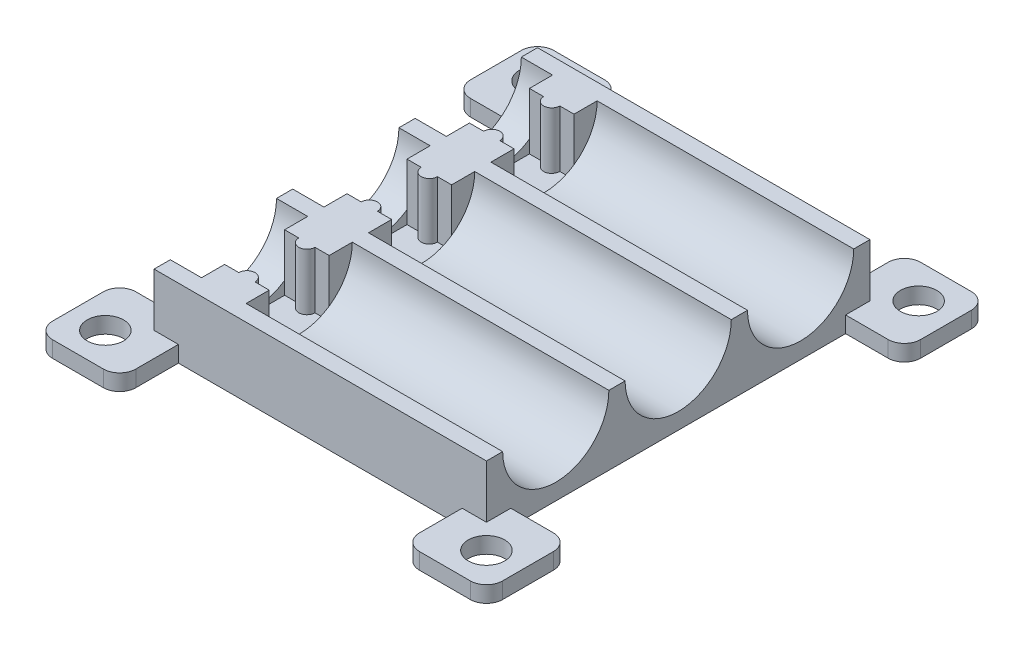
from build123d import *

# Parameters (mm, degrees)
BOSS_EXTRUDE1_DEPTH = 41
BOSS_EXTRUDE2_REACH = 50.098
SKETCH2_R           = 1
SKETCH4_W           = 5.5
SKETCH4_H           = 13.1
SKETCH4_R           = 1
CUT_EXTRUDE1_DEPTH  = 7
SKETCH5_R           = 2.25
BOSS_EXTRUDE3_DEPTH = 2
BOSS_EXTRUDE4_REACH = 59.938
SKETCH6_W           = 5.5
SKETCH6_H           = 2.85


with BuildPart() as part:
    # Sketch1 → Boss-Extrude1 (new body)
    with BuildSketch(Plane(origin=(0, 0, 0), x_dir=(0, 0, -1), z_dir=(1, 0, 0))):
        with BuildLine():
            Line((-8.55, 0), (-6.55, 0))
            ThreePointArc((-6.55, 0), (0, -6.55), (6.55, 0))
            Line((6.55, 0), (8.55, 0))
            ThreePointArc((8.55, 0), (15.1, -6.55), (21.65, 0))
            Line((21.65, 0), (23.65, 0))
            Line((23.65, 0), (23.65, -8.55))
            Line((23.65, -8.55), (-23.65, -8.55))
            Line((-23.65, -8.55), (-23.65, 0))
            Line((-23.65, 0), (-21.65, 0))
            ThreePointArc((-21.65, 0), (-15.1, -6.55), (-8.55, 0))
        make_face()
    extrude(amount=BOSS_EXTRUDE1_DEPTH)

    # Sketch2 → Boss-Extrude2 (add, up to next)
    with BuildSketch(Plane(origin=(0, 0, 0), x_dir=(1, 0, 0), z_dir=(0, 1, 0)), mode=Mode.PRIVATE) as boss_extrude2_sk1:
        with Locations(Location((6.6, 3.7, 0), (0, 0, 270))):
            Circle(SKETCH2_R)
    boss_extrude2_tool1 = extrude(boss_extrude2_sk1.sketch, amount=-BOSS_EXTRUDE2_REACH, mode=Mode.PRIVATE) - part.part
    # Sketch2 → Boss-Extrude2 (add, up to next)
    with BuildSketch(Plane(origin=(0, 0, 0), x_dir=(1, 0, 0), z_dir=(0, 1, 0)), mode=Mode.PRIVATE) as boss_extrude2_sk2:
        with Locations(Location((6.6, -3.7, 0), (0, 0, 270))):
            Circle(SKETCH2_R)
    boss_extrude2_tool2 = extrude(boss_extrude2_sk2.sketch, amount=-BOSS_EXTRUDE2_REACH, mode=Mode.PRIVATE) - part.part
    # Sketch2 → Boss-Extrude2 (add, up to next)
    with BuildSketch(Plane(origin=(0, 0, 0), x_dir=(1, 0, 0), z_dir=(0, 1, 0)), mode=Mode.PRIVATE) as boss_extrude2_sk3:
        with Locations(Location((6.6, -11.4, 0), (0, 0, 270))):
            Circle(SKETCH2_R)
    boss_extrude2_tool3 = extrude(boss_extrude2_sk3.sketch, amount=-BOSS_EXTRUDE2_REACH, mode=Mode.PRIVATE) - part.part
    # Sketch2 → Boss-Extrude2 (add, up to next)
    with BuildSketch(Plane(origin=(0, 0, 0), x_dir=(1, 0, 0), z_dir=(0, 1, 0)), mode=Mode.PRIVATE) as boss_extrude2_sk4:
        with Locations(Location((6.6, -18.8, 0), (0, 0, 270))):
            Circle(SKETCH2_R)
    boss_extrude2_tool4 = extrude(boss_extrude2_sk4.sketch, amount=-BOSS_EXTRUDE2_REACH, mode=Mode.PRIVATE) - part.part
    # Sketch2 → Boss-Extrude2 (add, up to next)
    with BuildSketch(Plane(origin=(0, 0, 0), x_dir=(1, 0, 0), z_dir=(0, 1, 0)), mode=Mode.PRIVATE) as boss_extrude2_sk5:
        with Locations(Location((6.6, 18.8, 0), (0, 0, 270))):
            Circle(SKETCH2_R)
    boss_extrude2_tool5 = extrude(boss_extrude2_sk5.sketch, amount=-BOSS_EXTRUDE2_REACH, mode=Mode.PRIVATE) - part.part
    # Sketch2 → Boss-Extrude2 (add, up to next)
    with BuildSketch(Plane(origin=(0, 0, 0), x_dir=(1, 0, 0), z_dir=(0, 1, 0)), mode=Mode.PRIVATE) as boss_extrude2_sk6:
        with Locations(Location((6.6, 11.4, 0), (0, 0, 270))):
            Circle(SKETCH2_R)
    boss_extrude2_tool6 = extrude(boss_extrude2_sk6.sketch, amount=-BOSS_EXTRUDE2_REACH, mode=Mode.PRIVATE) - part.part
    add(boss_extrude2_tool1.solids().sort_by_distance((6.6, 0, -3.7))[0])
    add(boss_extrude2_tool2.solids().sort_by_distance((6.6, 0, 3.7))[0])
    add(boss_extrude2_tool3.solids().sort_by_distance((6.6, 0, 11.4))[0])
    add(boss_extrude2_tool4.solids().sort_by_distance((6.6, 0, 18.8))[0])
    add(boss_extrude2_tool5.solids().sort_by_distance((6.6, 0, -18.8))[0])
    add(boss_extrude2_tool6.solids().sort_by_distance((6.6, 0, -11.4))[0])

    # Sketch4 → Cut-Extrude1 (cut)
    # profile 1 of 3: a face of its own
    with BuildSketch(Plane(origin=(0, 0, 0), x_dir=(1, 0, 0), z_dir=(0, 1, 0))):
        with Locations((6.6, 0)):
            Rectangle(SKETCH4_W, SKETCH4_H)
        with Locations(Location((6.6, 3.7, 0), (0, 0, 270))):
            Circle(SKETCH4_R, mode=Mode.SUBTRACT)
        with Locations(Location((6.6, -3.7, 0), (0, 0, 270))):
            Circle(SKETCH4_R, mode=Mode.SUBTRACT)
    # profile 2 of 3: a face of its own
    with BuildSketch(Plane(origin=(0, 0, 0), x_dir=(1, 0, 0), z_dir=(0, 1, 0))):
        with Locations((6.6, -15.1)):
            Rectangle(SKETCH4_W, SKETCH4_H)
        with Locations(Location((6.6, -11.4, 0), (0, 0, 90))):
            Circle(SKETCH4_R, mode=Mode.SUBTRACT)
        with Locations(Location((6.6, -18.8, 0), (0, 0, 90))):
            Circle(SKETCH4_R, mode=Mode.SUBTRACT)
    # profile 3 of 3: a face of its own
    with BuildSketch(Plane(origin=(0, 0, 0), x_dir=(1, 0, 0), z_dir=(0, 1, 0))):
        with Locations((6.6, 15.1)):
            Rectangle(SKETCH4_W, SKETCH4_H)
        with Locations(Location((6.6, 11.4, 0), (0, 0, 90))):
            Circle(SKETCH4_R, mode=Mode.SUBTRACT)
        with Locations(Location((6.6, 18.8, 0), (0, 0, 90))):
            Circle(SKETCH4_R, mode=Mode.SUBTRACT)
    extrude(amount=-CUT_EXTRUDE1_DEPTH, mode=Mode.SUBTRACT)

    # Sketch5 → Boss-Extrude3 (add)
    # profile 1 of 4: a face of its own
    with BuildSketch(Plane.XZ.offset(8.55)):
        with BuildLine():
            Line((0, 23.65), (0, 20.65))
            Line((0, 20.65), (-5.25520382, 20.65))
            ThreePointArc((-5.25520382, 20.65), (-6.669417382, 21.235786438), (-7.25520382, 22.65))
            Line((-7.25520382, 22.65), (-7.25520382, 28.90520382))
            ThreePointArc((-7.25520382, 28.90520382), (-6.669417382, 30.319417382), (-5.25520382, 30.90520382))
            Line((-5.25520382, 30.90520382), (1, 30.90520382))
            ThreePointArc((1, 30.90520382), (2.414213562, 30.319417382), (3, 28.90520382))
            Line((3, 28.90520382), (3, 23.65))
            Line((3, 23.65), (0, 23.65))
        make_face()
        with Locations(Location((-3.00520382, 26.65520382, 0), (0, 0, 270))):
            Circle(SKETCH5_R, mode=Mode.SUBTRACT)
    # profile 2 of 4: a face of its own
    with BuildSketch(Plane.XZ.offset(8.55)):
        with BuildLine():
            Line((0, -23.65), (3, -23.65))
            Line((3, -23.65), (3, -28.90520382))
            ThreePointArc((3, -28.90520382), (2.414213562, -30.319417382), (1, -30.90520382))
            Line((1, -30.90520382), (-5.25520382, -30.90520382))
            ThreePointArc((-5.25520382, -30.90520382), (-6.669417382, -30.319417382), (-7.25520382, -28.90520382))
            Line((-7.25520382, -28.90520382), (-7.25520382, -22.65))
            ThreePointArc((-7.25520382, -22.65), (-6.669417382, -21.235786438), (-5.25520382, -20.65))
            Line((-5.25520382, -20.65), (0, -20.65))
            Line((0, -20.65), (0, -23.65))
        make_face()
        with Locations(Location((-3.00520382, -26.65520382, 0), (0, 0, 90))):
            Circle(SKETCH5_R, mode=Mode.SUBTRACT)
    # profile 3 of 4: a face of its own
    with BuildSketch(Plane.XZ.offset(8.55)):
        with BuildLine():
            Line((41, -23.65), (41, -20.65))
            Line((41, -20.65), (46.25520382, -20.65))
            ThreePointArc((46.25520382, -20.65), (47.669417382, -21.235786438), (48.25520382, -22.65))
            Line((48.25520382, -22.65), (48.25520382, -28.90520382))
            ThreePointArc((48.25520382, -28.90520382), (47.669417382, -30.319417382), (46.25520382, -30.90520382))
            Line((46.25520382, -30.90520382), (40, -30.90520382))
            ThreePointArc((40, -30.90520382), (38.585786438, -30.319417382), (38, -28.90520382))
            Line((38, -28.90520382), (38, -23.65))
            Line((38, -23.65), (41, -23.65))
        make_face()
        with Locations(Location((44.00520382, -26.65520382, 0), (0, 0, 270))):
            Circle(SKETCH5_R, mode=Mode.SUBTRACT)
    # profile 4 of 4: a face of its own
    with BuildSketch(Plane.XZ.offset(8.55)):
        with BuildLine():
            Line((41, 23.65), (38, 23.65))
            Line((38, 23.65), (38, 28.90520382))
            ThreePointArc((38, 28.90520382), (38.585786438, 30.319417382), (40, 30.90520382))
            Line((40, 30.90520382), (46.25520382, 30.90520382))
            ThreePointArc((46.25520382, 30.90520382), (47.669417382, 30.319417382), (48.25520382, 28.90520382))
            Line((48.25520382, 28.90520382), (48.25520382, 22.65))
            ThreePointArc((48.25520382, 22.65), (47.669417382, 21.235786438), (46.25520382, 20.65))
            Line((46.25520382, 20.65), (41, 20.65))
            Line((41, 20.65), (41, 23.65))
        make_face()
        with Locations(Location((44.00520382, 26.65520382, 0), (0, 0, 90))):
            Circle(SKETCH5_R, mode=Mode.SUBTRACT)
    extrude(amount=-BOSS_EXTRUDE3_DEPTH)

    # Boss-Extrude4: up to this face of the body (flat: up to its plane)
    boss_extrude4_end = Plane(part.part.faces().sort_by_distance((6.6, -7, -15.1))[0])
    # Sketch6 → Boss-Extrude4 (add, up to the picked face)
    with BuildSketch(Plane(origin=(0, 0, 0), x_dir=(1, 0, 0), z_dir=(0, 1, 0)), mode=Mode.PRIVATE) as boss_extrude4_sk1:
        with Locations((6.6, -5.125)):
            Rectangle(SKETCH6_W, SKETCH6_H)
    boss_extrude4_tool1 = split(extrude(boss_extrude4_sk1.sketch, amount=-BOSS_EXTRUDE4_REACH, mode=Mode.PRIVATE), bisect_by=boss_extrude4_end, keep=Keep.BOTH, mode=Mode.PRIVATE)
    # Sketch6 → Boss-Extrude4 (add, up to the picked face)
    with BuildSketch(Plane(origin=(0, 0, 0), x_dir=(1, 0, 0), z_dir=(0, 1, 0)), mode=Mode.PRIVATE) as boss_extrude4_sk2:
        with Locations((6.6, 5.125)):
            Rectangle(SKETCH6_W, SKETCH6_H)
    boss_extrude4_tool2 = split(extrude(boss_extrude4_sk2.sketch, amount=-BOSS_EXTRUDE4_REACH, mode=Mode.PRIVATE), bisect_by=boss_extrude4_end, keep=Keep.BOTH, mode=Mode.PRIVATE)
    # Sketch6 → Boss-Extrude4 (add, up to the picked face)
    with BuildSketch(Plane(origin=(0, 0, 0), x_dir=(1, 0, 0), z_dir=(0, 1, 0)), mode=Mode.PRIVATE) as boss_extrude4_sk3:
        with Locations((6.6, -20.225)):
            Rectangle(SKETCH6_W, SKETCH6_H)
    boss_extrude4_tool3 = split(extrude(boss_extrude4_sk3.sketch, amount=-BOSS_EXTRUDE4_REACH, mode=Mode.PRIVATE), bisect_by=boss_extrude4_end, keep=Keep.BOTH, mode=Mode.PRIVATE)
    # Sketch6 → Boss-Extrude4 (add, up to the picked face)
    with BuildSketch(Plane(origin=(0, 0, 0), x_dir=(1, 0, 0), z_dir=(0, 1, 0)), mode=Mode.PRIVATE) as boss_extrude4_sk4:
        with Locations((6.6, -9.975)):
            Rectangle(SKETCH6_W, SKETCH6_H)
    boss_extrude4_tool4 = split(extrude(boss_extrude4_sk4.sketch, amount=-BOSS_EXTRUDE4_REACH, mode=Mode.PRIVATE), bisect_by=boss_extrude4_end, keep=Keep.BOTH, mode=Mode.PRIVATE)
    # Sketch6 → Boss-Extrude4 (add, up to the picked face)
    with BuildSketch(Plane(origin=(0, 0, 0), x_dir=(1, 0, 0), z_dir=(0, 1, 0)), mode=Mode.PRIVATE) as boss_extrude4_sk5:
        with Locations((6.6, 9.975)):
            Rectangle(SKETCH6_W, SKETCH6_H)
    boss_extrude4_tool5 = split(extrude(boss_extrude4_sk5.sketch, amount=-BOSS_EXTRUDE4_REACH, mode=Mode.PRIVATE), bisect_by=boss_extrude4_end, keep=Keep.BOTH, mode=Mode.PRIVATE)
    # Sketch6 → Boss-Extrude4 (add, up to the picked face)
    with BuildSketch(Plane(origin=(0, 0, 0), x_dir=(1, 0, 0), z_dir=(0, 1, 0)), mode=Mode.PRIVATE) as boss_extrude4_sk6:
        with Locations((6.6, 20.225)):
            Rectangle(SKETCH6_W, SKETCH6_H)
    boss_extrude4_tool6 = split(extrude(boss_extrude4_sk6.sketch, amount=-BOSS_EXTRUDE4_REACH, mode=Mode.PRIVATE), bisect_by=boss_extrude4_end, keep=Keep.BOTH, mode=Mode.PRIVATE)
    add(boss_extrude4_tool1.solids().sort_by(Axis((6.6, 0, 5.125), (0, -1, 0)))[0])
    add(boss_extrude4_tool2.solids().sort_by(Axis((6.6, 0, -5.125), (0, -1, 0)))[0])
    add(boss_extrude4_tool3.solids().sort_by(Axis((6.6, 0, 20.225), (0, -1, 0)))[0])
    add(boss_extrude4_tool4.solids().sort_by(Axis((6.6, 0, 9.975), (0, -1, 0)))[0])
    add(boss_extrude4_tool5.solids().sort_by(Axis((6.6, 0, -9.975), (0, -1, 0)))[0])
    add(boss_extrude4_tool6.solids().sort_by(Axis((6.6, 0, -20.225), (0, -1, 0)))[0])


solid = part.part
